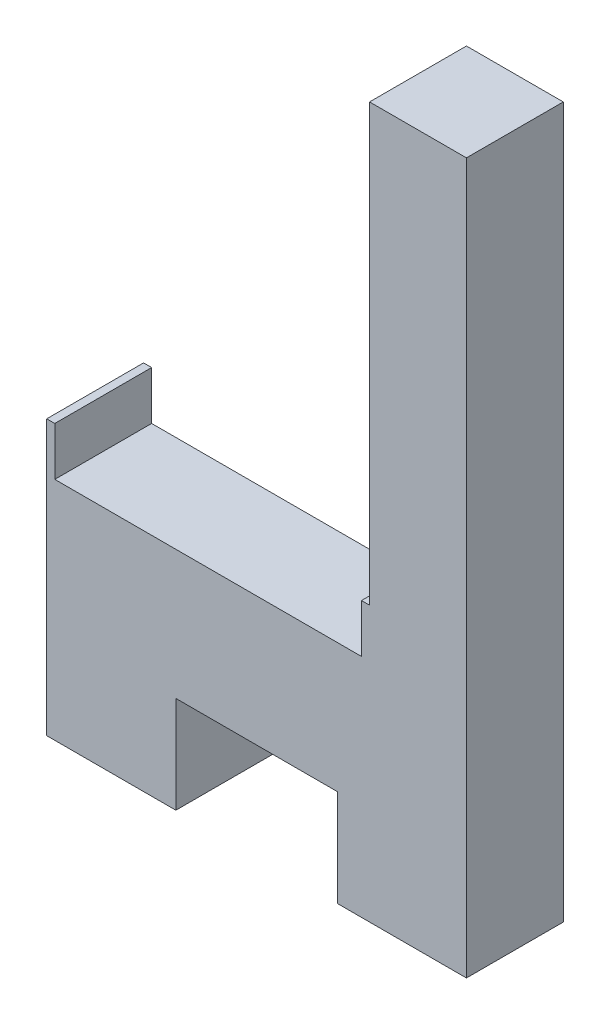
from build123d import *

# Parameters (mm, degrees)
BOSS_EXTRU_1_DEPTH = 6


with BuildPart() as part:
    # Esquisse1 → Boss.-Extru.1 (new body)
    with BuildSketch(Plane.XY):
        Polygon((13, -22), (13, 22), (7, 22), (7, -5), (6.5, -5), (6.5, -8), (-12.5, -8), (-12.5, -5), (-13, -5), (-13, -22), (-5, -22), (-5, -16), (5, -16), (5, -22), align=None)
    extrude(amount=BOSS_EXTRU_1_DEPTH)


solid = part.part
